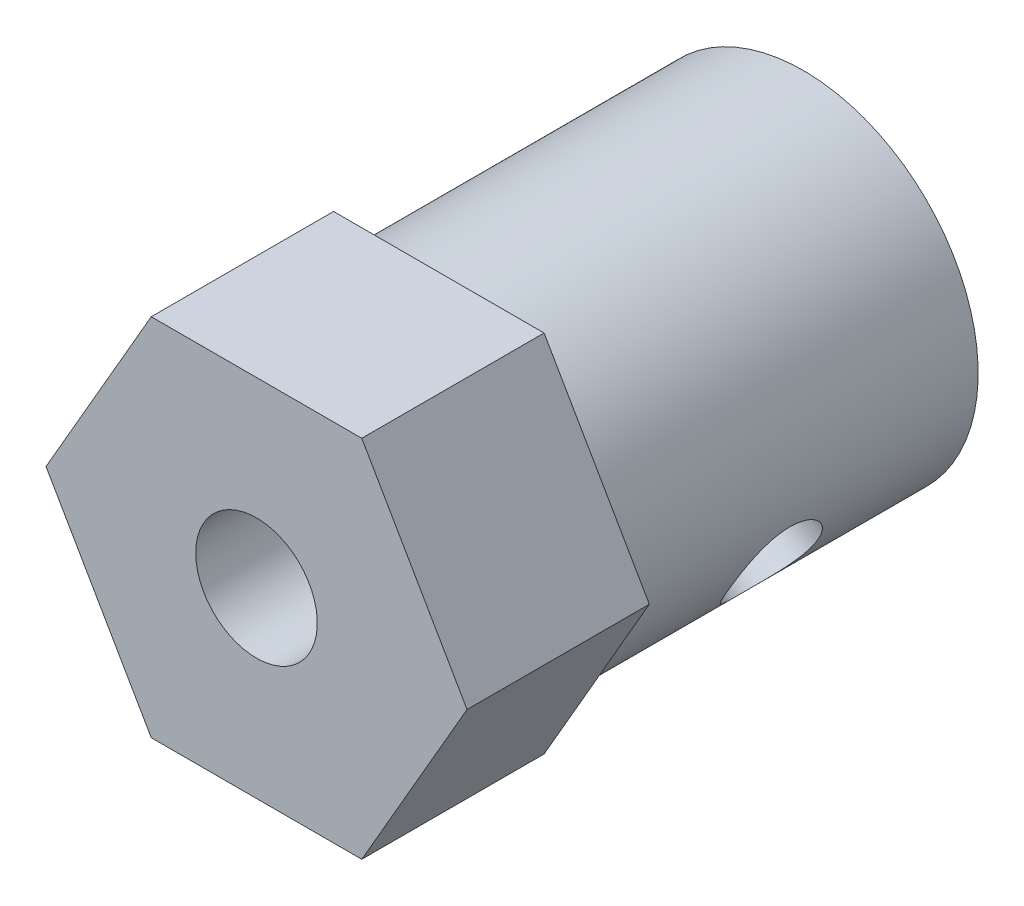
from build123d import *

# Parameters (mm, degrees)
BOSS_EXTRUDE1_DEPTH = 6
SKETCH2_R           = 5.75
BOSS_EXTRUDE2_DEPTH = 12
SKETCH4_R           = 2
CUT_EXTRUDE2_DEPTH  = 21.199009877
SKETCH5_R           = 1.5
CUT_EXTRUDE3_DEPTH  = 6


with BuildPart() as part:
    # Sketch1 → Boss-Extrude1 (new body)
    with BuildSketch(Plane(origin=(0, 0, 0), x_dir=(0, 1, 0), z_dir=(0, 0, 1))):
        Polygon((0, 6.92820323), (-6, 3.464101615), (-6, -3.464101615), (0, -6.92820323), (6, -3.464101615), (6, 3.464101615), align=None)
    extrude(amount=BOSS_EXTRUDE1_DEPTH)

    # Sketch2 → Boss-Extrude2 (add)
    with BuildSketch(Plane(origin=(0, 0, 0), x_dir=(1, 0, 0), z_dir=(0, 0, -1))):
        with Locations(Location((0, 0, 0), (0, 0, 180))):
            Circle(SKETCH2_R)
    extrude(amount=BOSS_EXTRUDE2_DEPTH)

    # Sketch4 → Cut-Extrude2 (cut, through all)
    with BuildSketch(Plane(origin=(0, 0, -12), x_dir=(1, 0, 0), z_dir=(0, 0, -1))):
        with Locations(Location((0, 0, 0), (0, 0, 180))):
            Circle(SKETCH4_R)
    extrude(amount=-CUT_EXTRUDE2_DEPTH, mode=Mode.SUBTRACT)

    # Sketch5 → Cut-Extrude3 (cut)
    with BuildSketch(Plane(origin=(5.196152423, -3, 0), x_dir=(0.49999999999999506, 0.8660254037844415, 0), z_dir=(0.8660254037844415, -0.49999999999999506, 0))):
        with Locations((0, -6)):
            Circle(SKETCH5_R)
    extrude(amount=-CUT_EXTRUDE3_DEPTH, mode=Mode.SUBTRACT)


solid = part.part
